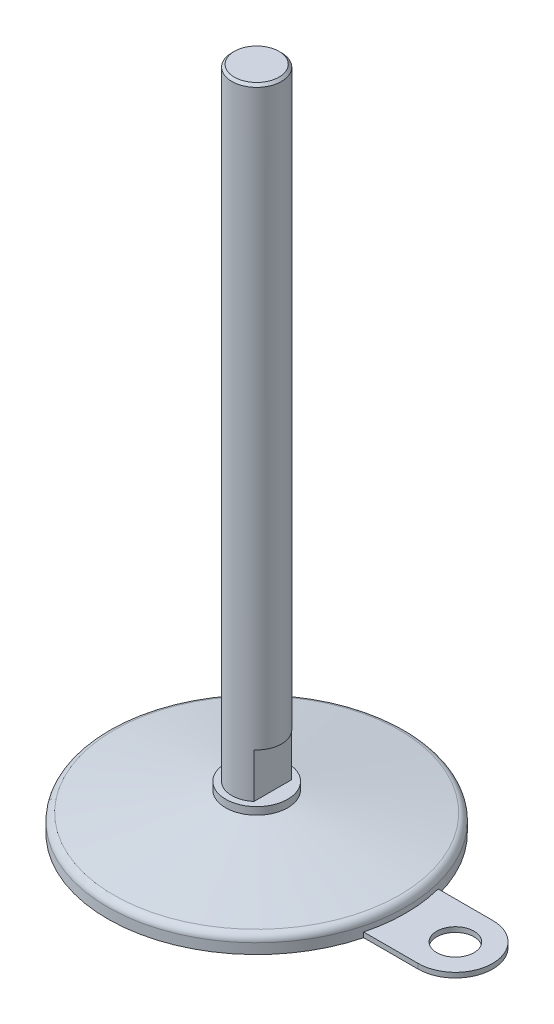
from build123d import *

# Parameters (mm, degrees)
FASE1_SIZE                      = 1
SKIZZE2_W                       = 3.5
SKIZZE2_H                       = 18
SCHNITT_LINEAR_AUSTRAGEN1_DEPTH = 10
SKIZZE3_R                       = 7.5
AUFSATZ_LINEAR_AUSTRAGEN1_DEPTH = 2


with BuildPart() as part:
    # Skizze1 → Rotation1 (revolve)
    with BuildSketch(Plane.XY):
        with BuildLine():
            Line((0, 0), (-55, 0))
            Line((-55, 0), (-55, 2))
            Line((-55, 2), (-60, 2))
            Line((-60, 2), (-60, 6.107169523))
            ThreePointArc((-60, 6.107169523), (-59.298133329, 8.035532352), (-57.520944533, 9.061592782))
            Line((-57.520944533, 9.061592782), (-12.5, 17))
            Line((-12.5, 17), (-12.5, 20))
            Line((-12.5, 20), (-10, 20))
            Line((-10, 20), (-10, 270))
            Line((-10, 270), (0, 270))
            Line((0, 270), (0, 0))
        make_face()
    revolve(axis=Axis((0, 290, 0), (0, -1, 0)))

    # Fase1
    fase1_edges = [part.edges().sort_by_distance(p)[0] for p in [
        (10, 270, 0),
    ]]
    chamfer(fase1_edges, length=FASE1_SIZE)

    # Skizze2 → Schnitt-Linear austragen1 (cut, symmetric)
    with BuildSketch(Plane.XY):
        with Locations((-8.25, 29)):
            Rectangle(SKIZZE2_W, SKIZZE2_H)
        with Locations((8.25, 29)):
            Rectangle(SKIZZE2_W, SKIZZE2_H)
    extrude(amount=SCHNITT_LINEAR_AUSTRAGEN1_DEPTH, both=True, mode=Mode.SUBTRACT)

    # Skizze3 → Aufsatz-Linear austragen1 (add)
    with BuildSketch(Plane.XZ.offset(-2)):
        with BuildLine():
            Line((0, 15), (0, -15))
            Line((0, -15), (80, -15))
            ThreePointArc((80, -15), (95, 0), (80, 15))
            Line((80, 15), (0, 15))
        make_face()
        with Locations((80, 0)):
            Circle(SKIZZE3_R, mode=Mode.SUBTRACT)
    extrude(amount=-AUFSATZ_LINEAR_AUSTRAGEN1_DEPTH)


solid = part.part
